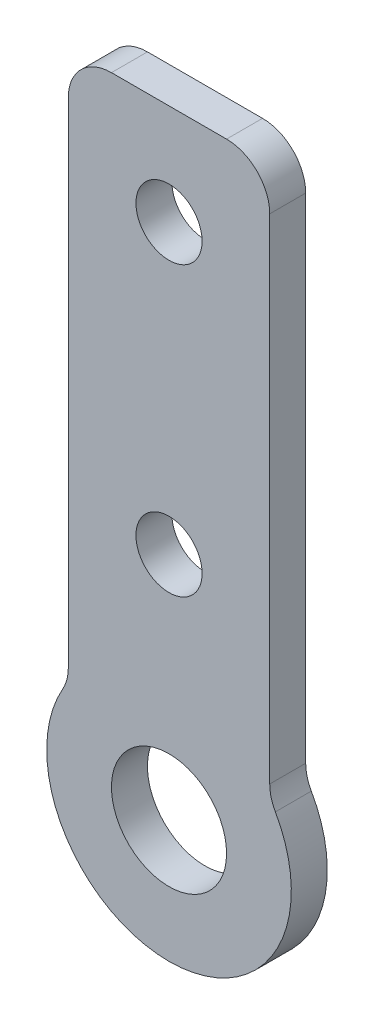
from build123d import *

# Parameters (mm, degrees)
SKETCH_1_R      = 4
SKETCH_1_R_2    = 2.3
EXTRUDE_1_DEPTH = 1.25
FILLET_1_R      = 3


with BuildPart() as part:
    # 草图1 → 凸台-拉伸1 (new, symmetric)
    with BuildSketch(Plane.XY):
        with BuildLine():
            Line((-7, 4.82182538), (-7, 43))
            Line((-7, 43), (7, 43))
            Line((7, 43), (7, 4.82182538))
            ThreePointArc((7, 4.82182538), (0, -8.5), (-7, 4.82182538))
        make_face()
        Circle(SKETCH_1_R, mode=Mode.SUBTRACT)
        with Locations((0, 36)):
            Circle(SKETCH_1_R_2, mode=Mode.SUBTRACT)
        with Locations((0, 16)):
            Circle(SKETCH_1_R_2, mode=Mode.SUBTRACT)
    extrude(amount=EXTRUDE_1_DEPTH, both=True)

    # 圆角1
    fillet_1_edges = [part.edges().sort_by_distance(p)[0] for p in [
        (-7, 4.82182538, 0),
        (-7, 43, 0),
        (7, 43, 0),
        (7, 4.82182538, 0),
    ]]
    fillet(fillet_1_edges, radius=FILLET_1_R)


solid = part.part
